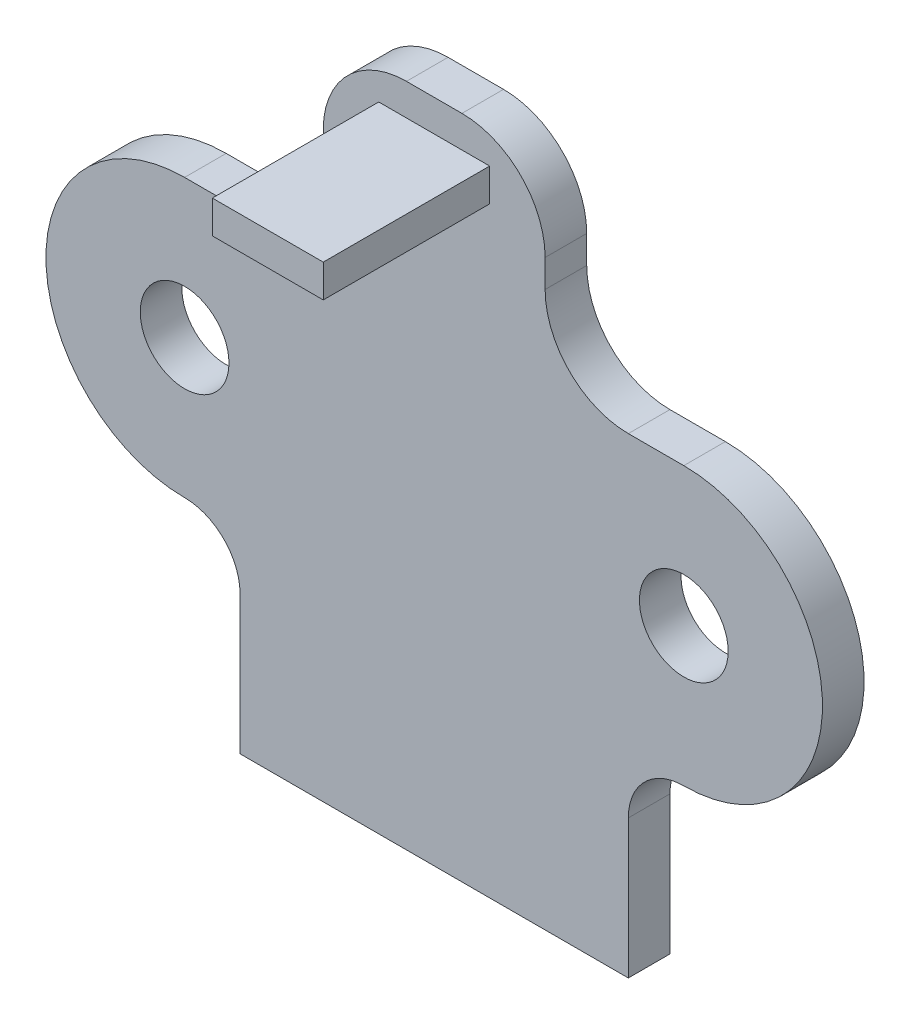
from build123d import *

# Parameters (mm, degrees)
BOSS_EXTRUDE1_DEPTH        = 1.5
F_3_2_3_2_DIAMETER_HOLE1_D = 3.2
SKETCH5_W                  = 4
SKETCH5_H                  = 1.181538701
BOSS_EXTRUDE2_DEPTH        = 6


with BuildPart() as part:
    # Sketch1 → Boss-Extrude1 (new body)
    with BuildSketch(Plane.XY.offset(1.5)):
        with BuildLine():
            Line((-4, 9), (-4, 8))
            ThreePointArc((-4, 8), (-4.878679656, 5.878679656), (-7, 5))
            Line((-7, 5), (-9, 5))
            ThreePointArc((-9, 5), (-14, 0), (-9, -5))
            ThreePointArc((-9, -5), (-7.585786438, -5.585786438), (-7, -7))
            Line((-7, -7), (-7, -12))
            Line((-7, -12), (7, -12))
            Line((7, -12), (7, -7))
            ThreePointArc((7, -7), (7.585786438, -5.585786438), (9, -5))
            ThreePointArc((9, -5), (14, 0), (9, 5))
            Line((9, 5), (7, 5))
            ThreePointArc((7, 5), (4.878679656, 5.878679656), (4, 8))
            Line((4, 8), (4, 9))
            ThreePointArc((4, 9), (3.121320344, 11.121320344), (1, 12))
            Line((1, 12), (-1, 12))
            ThreePointArc((-1, 12), (-3.121320344, 11.121320344), (-4, 9))
        make_face()
    extrude(amount=-BOSS_EXTRUDE1_DEPTH)

    # Ø3.2 (3.2) Diameter Hole1 (through all)
    with Locations(Plane.XY.offset(1.5)):
        with Locations((-9, 0)):
            f_3_2_3_2_diameter_hole1 = Hole(F_3_2_3_2_DIAMETER_HOLE1_D / 2)

    # Mirror1: Ø3.2 (3.2) Diameter Hole1 across plane
    add(f_3_2_3_2_diameter_hole1.mirror(Plane(origin=(0, 0, 0), x_dir=(0, 0, 1), z_dir=(1, 0, 0))), mode=Mode.SUBTRACT)

    # Sketch5 → Boss-Extrude2 (add)
    with BuildSketch(Plane.XY.offset(1.5)):
        with Locations((0, 10.264616907)):
            Rectangle(SKETCH5_W, SKETCH5_H)
    extrude(amount=BOSS_EXTRUDE2_DEPTH)


solid = part.part
